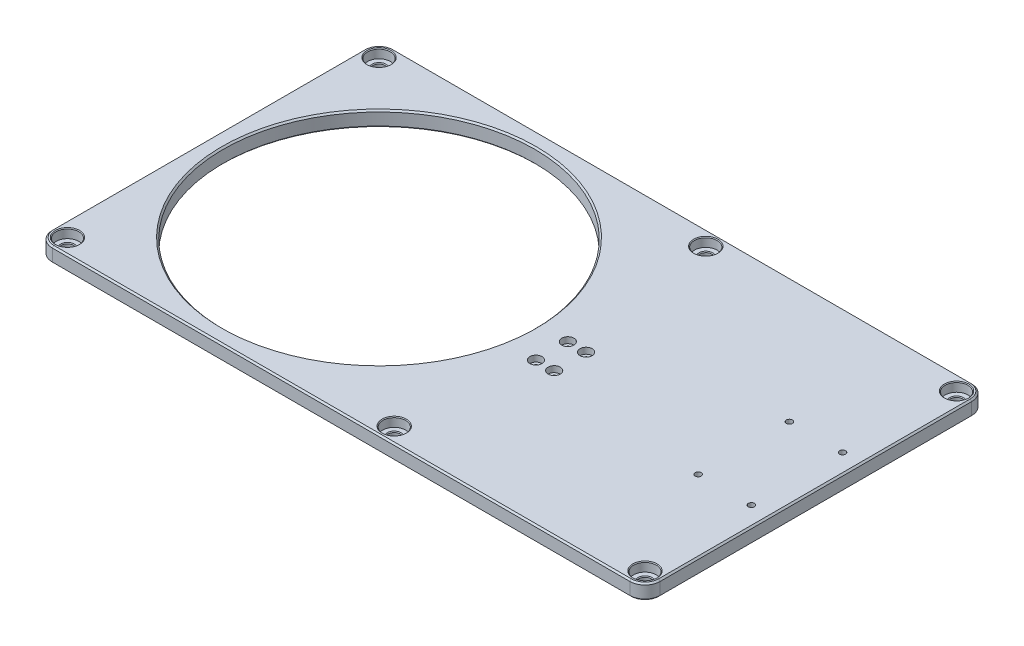
from build123d import *

# Parameters (mm, degrees)
SKICA1_W                 = 400
SKICA1_H                 = 225
P_IDAT_VYSUNUT_M1_DEPTH  = 10
SKICA2_R                 = 102.5
ODEBRAT_VYSUNUT_M1_DEPTH = 10
ZAOBLIT1_R               = 10
SKICA3_R                 = 4
ODEBRAT_VYSUNUT_M2_DEPTH = 10
SKICA4_R                 = 7.5
ODEBRAT_VYSUNUT_M3_DEPTH = 6
ZKOSEN_1_SIZE            = 0.5
ZKOSEN_2_SIZE            = 1
ZKOSEN_3_SIZE            = 1
SKICA5_R                 = 2
ODEBRAT_VYSUNUT_M4_DEPTH = 10
SKICA6_R                 = 2
ODEBRAT_VYSUNUT_M5_DEPTH = 10
SKICA7_R                 = 4
ODEBRAT_VYSUNUT_M6_DEPTH = 4


with BuildPart() as part:
    # Skica1 → Přidat vysunutím1 (new body)
    with BuildSketch(Plane(origin=(0, 0, 0), x_dir=(1, 0, 0), z_dir=(0, 1, 0))):
        with Locations((200, 112.5)):
            Rectangle(SKICA1_W, SKICA1_H)
    extrude(amount=P_IDAT_VYSUNUT_M1_DEPTH)

    # Skica2 → Odebrat vysunutím1 (cut)
    with BuildSketch(Plane(origin=(0, 10, 0), x_dir=(1, 0, 0), z_dir=(0, 1, 0))):
        with Locations(Location((112.5, 112.5, 0), (0, 0, 270))):
            Circle(SKICA2_R)
    extrude(amount=-ODEBRAT_VYSUNUT_M1_DEPTH, mode=Mode.SUBTRACT)

    # Zaoblit1
    zaoblit1_edges = [part.edges().sort_by_distance(p)[0] for p in [
        (0, 5, -225),
        (400, 5, -225),
        (400, 5, 0),
        (0, 5, 0),
    ]]
    fillet(zaoblit1_edges, radius=ZAOBLIT1_R)

    # Skica3 → Odebrat vysunutím2 (cut)
    with BuildSketch(Plane(origin=(0, 10, 0), x_dir=(1, 0, 0), z_dir=(0, 1, 0))):
        with Locations(Location((10, 215, 0), (0, 0, 270))):
            Circle(SKICA3_R)
        with Locations(Location((390, 215, 0), (0, 0, 270))):
            Circle(SKICA3_R)
        with Locations(Location((10, 10, 0), (0, 0, 270))):
            Circle(SKICA3_R)
        with Locations(Location((390, 10, 0), (0, 0, 270))):
            Circle(SKICA3_R)
        with Locations(Location((225, 215, 0), (0, 0, 270))):
            Circle(SKICA3_R)
        with Locations(Location((225, 10, 0), (0, 0, 270))):
            Circle(SKICA3_R)
    extrude(amount=-ODEBRAT_VYSUNUT_M2_DEPTH, mode=Mode.SUBTRACT)

    # Skica4 → Odebrat vysunutím3 (cut)
    with BuildSketch(Plane(origin=(0, 10, 0), x_dir=(1, 0, 0), z_dir=(0, 1, 0))):
        with Locations(Location((10, 215, 0), (0, 0, 270))):
            Circle(SKICA4_R)
        with Locations(Location((390, 215, 0), (0, 0, 270))):
            Circle(SKICA4_R)
        with Locations(Location((10, 10, 0), (0, 0, 270))):
            Circle(SKICA4_R)
        with Locations(Location((390, 10, 0), (0, 0, 270))):
            Circle(SKICA4_R)
        with Locations(Location((225, 215, 0), (0, 0, 270))):
            Circle(SKICA4_R)
        with Locations(Location((225, 10, 0), (0, 0, 270))):
            Circle(SKICA4_R)
    extrude(amount=-ODEBRAT_VYSUNUT_M3_DEPTH, mode=Mode.SUBTRACT)

    # Zkosení1
    zkosen_1_edges = [part.edges().sort_by_distance(p)[0] for p in [
        (225, 0, -219),
        (390, 0, -14),
        (10, 0, -14),
        (390, 0, -219),
        (225, 0, -14),
        (10, 0, -219),
        (225, 10, -222.5),
        (225, 4, -219),
        (390, 10, -17.5),
        (390, 4, -14),
        (10, 10, -17.5),
        (10, 4, -14),
        (390, 10, -222.5),
        (390, 4, -219),
        (225, 10, -17.5),
        (225, 4, -14),
        (10, 10, -222.5),
        (10, 4, -219),
    ]]
    chamfer(zkosen_1_edges, length=ZKOSEN_1_SIZE)

    # Zkosení2
    zkosen_2_edges = [part.edges().sort_by_distance(p)[0] for p in [
        (112.5, 10, -215),
        (112.5, 0, -215),
    ]]
    chamfer(zkosen_2_edges, length=ZKOSEN_2_SIZE)

    # Zkosení3
    zkosen_3_edges = [part.edges().sort_by_distance(p)[0] for p in [
        (200, 0, -225),
        (200, 10, -225),
        (0, 0, -112.5),
        (400, 0, -112.5),
        (200, 0, 0),
        (2.928932188, 0, -2.928932188),
        (2.928932188, 0, -222.071067812),
        (397.071067812, 0, -2.928932188),
        (397.071067812, 0, -222.071067812),
        (400, 10, -112.5),
        (0, 10, -112.5),
        (200, 10, 0),
        (2.928932188, 10, -2.928932188),
        (2.928932188, 10, -222.071067812),
        (397.071067812, 10, -2.928932188),
        (397.071067812, 10, -222.071067812),
    ]]
    chamfer(zkosen_3_edges, length=ZKOSEN_3_SIZE)

    # Skica5 → Odebrat vysunutím4 (cut)
    with BuildSketch(Plane(origin=(0, 10, 0), x_dir=(1, 0, 0), z_dir=(0, 1, 0))):
        with Locations(Location((352.5, 142.5, 0), (0, 0, 270))):
            Circle(SKICA5_R)
        with Locations(Location((387.5, 142.5, 0), (0, 0, 270))):
            Circle(SKICA5_R)
        with Locations(Location((387.5, 82.5, 0), (0, 0, 270))):
            Circle(SKICA5_R)
        with Locations(Location((352.5, 82.5, 0), (0, 0, 270))):
            Circle(SKICA5_R)
    extrude(amount=-ODEBRAT_VYSUNUT_M4_DEPTH, mode=Mode.SUBTRACT)

    # Skica6 → Odebrat vysunutím5 (cut)
    with BuildSketch(Plane(origin=(0, 10, 0), x_dir=(1, 0, 0), z_dir=(0, 1, 0))):
        with Locations(Location((234, 115.25, 0), (0, 0, 270))):
            Circle(SKICA6_R)
        with Locations(Location((246, 115.25, 0), (0, 0, 270))):
            Circle(SKICA6_R)
        with Locations(Location((246, 94.25, 0), (0, 0, 90))):
            Circle(SKICA6_R)
        with Locations(Location((234, 94.25, 0), (0, 0, 90))):
            Circle(SKICA6_R)
    extrude(amount=-ODEBRAT_VYSUNUT_M5_DEPTH, mode=Mode.SUBTRACT)

    # Skica7 → Odebrat vysunutím6 (cut)
    with BuildSketch(Plane(origin=(0, 10, 0), x_dir=(1, 0, 0), z_dir=(0, 1, 0))):
        with Locations(Location((234, 115.25, 0), (0, 0, 270))):
            Circle(SKICA7_R)
        with Locations(Location((246, 115.25, 0), (0, 0, 270))):
            Circle(SKICA7_R)
        with Locations(Location((234, 94.25, 0), (0, 0, 270))):
            Circle(SKICA7_R)
        with Locations(Location((246, 94.25, 0), (0, 0, 270))):
            Circle(SKICA7_R)
    extrude(amount=-ODEBRAT_VYSUNUT_M6_DEPTH, mode=Mode.SUBTRACT)


solid = part.part
